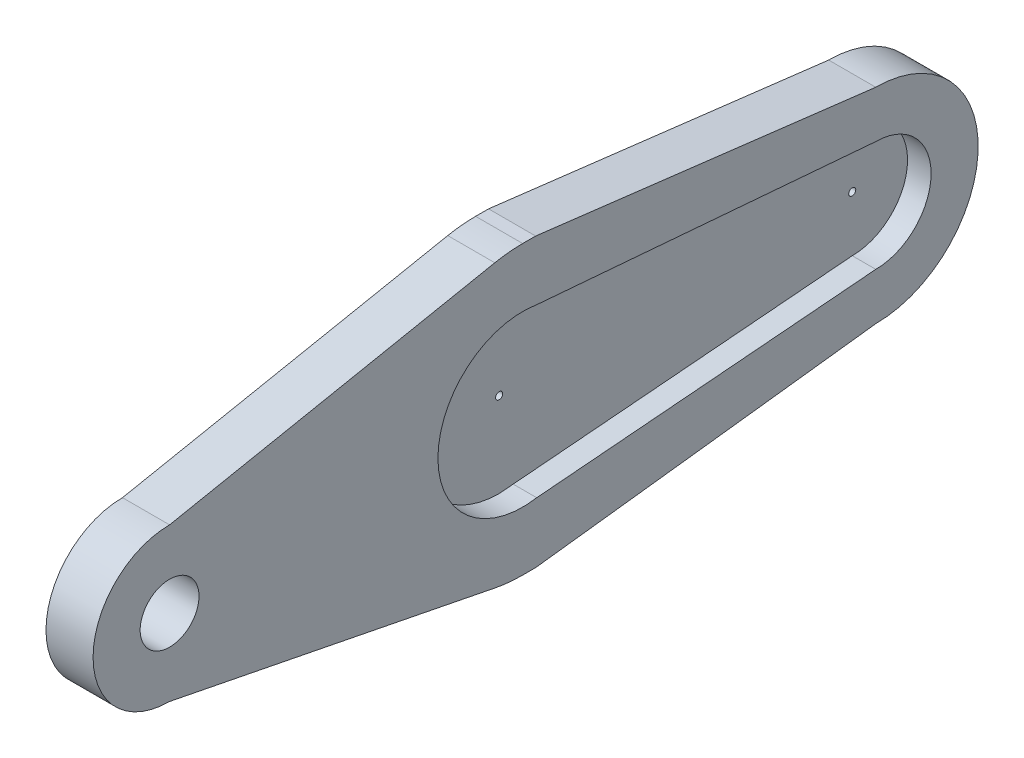
from build123d import *

# Parameters (mm, degrees)
SKETCH2_R           = 1.25
BOSS_EXTRUDE1_DEPTH = 2
BOSS_EXTRUDE2_DEPTH = 1
SKETCH3_R           = 0.15
CUT_EXTRUDE1_DEPTH  = 0.5


with BuildPart() as part:
    # Sketch2 → Boss-Extrude1 (new body)
    with BuildSketch(Plane.YZ):
        with BuildLine():
            ThreePointArc((-4.35, -14.45), (-3.075914484, -17.525914513), (4.1e-08, -18.8))
            ThreePointArc((4.1e-08, -18.8), (3.075914513, -17.525914484), (4.35, -14.45))
            Line((4.35, -14.45), (6.1, 0))
            Line((6.1, 0), (6.1, 0.55))
            ThreePointArc((6.1, 0.55), (6.070921356, 1.144906627), (5.983962658, 1.734141424))
            Line((5.983962658, 1.734141424), (3.25, 15.55))
            ThreePointArc((3.25, 15.55), (2.298097039, 17.848097039), (0, 18.8))
            ThreePointArc((0, 18.8), (-2.298097039, 17.848097039), (-3.25, 15.55))
            Line((-3.25, 15.55), (-5.983962658, 1.734141424))
            ThreePointArc((-5.983962658, 1.734141424), (-6.070921356, 1.144906627), (-6.1, 0.55))
            Line((-6.1, 0.55), (-6.1, 0))
            Line((-6.1, 0), (-4.35, -14.45))
        make_face()
        with BuildLine():
            Line((3.550344828, -0.045862069), (2.35, -14.45))
            ThreePointArc((2.35, -14.45), (0, -16.8), (-2.35, -14.45))
            Line((-2.35, -14.45), (-3.550344828, -0.045862069))
            ThreePointArc((-3.550344828, -0.045862069), (-3.58756473, 0.251036273), (-3.6, 0.55))
            ThreePointArc((-3.6, 0.55), (0, 4.15), (3.6, 0.55))
            ThreePointArc((3.6, 0.55), (3.58756473, 0.251036273), (3.550344828, -0.045862069))
        make_face(mode=Mode.SUBTRACT)
        with Locations((0, 15.55)):
            Circle(SKETCH2_R, mode=Mode.SUBTRACT)
    extrude(amount=BOSS_EXTRUDE1_DEPTH)

    # Sketch2<3> → Boss-Extrude2 (add)
    with BuildSketch(Plane.YZ):
        with BuildLine():
            ThreePointArc((-2.35, -14.45), (0, -16.8), (2.35, -14.45))
            Line((2.35, -14.45), (3.550344828, -0.045862069))
            Line((3.550344828, -0.045862069), (3.6, 0.55))
            ThreePointArc((3.6, 0.55), (0, 4.15), (-3.6, 0.55))
            Line((-3.6, 0.55), (-3.550344828, -0.045862069))
            Line((-3.550344828, -0.045862069), (-2.35, -14.45))
        make_face()
    extrude(amount=BOSS_EXTRUDE2_DEPTH)

    # Sketch3 → Cut-Extrude1 (cut)
    with BuildSketch(Plane.YZ.offset(1)):
        with Locations((0, 0.55)):
            Circle(SKETCH3_R)
        with Locations((0, -14.45)):
            Circle(SKETCH3_R)
    extrude(amount=-CUT_EXTRUDE1_DEPTH, mode=Mode.SUBTRACT)


solid = part.part
